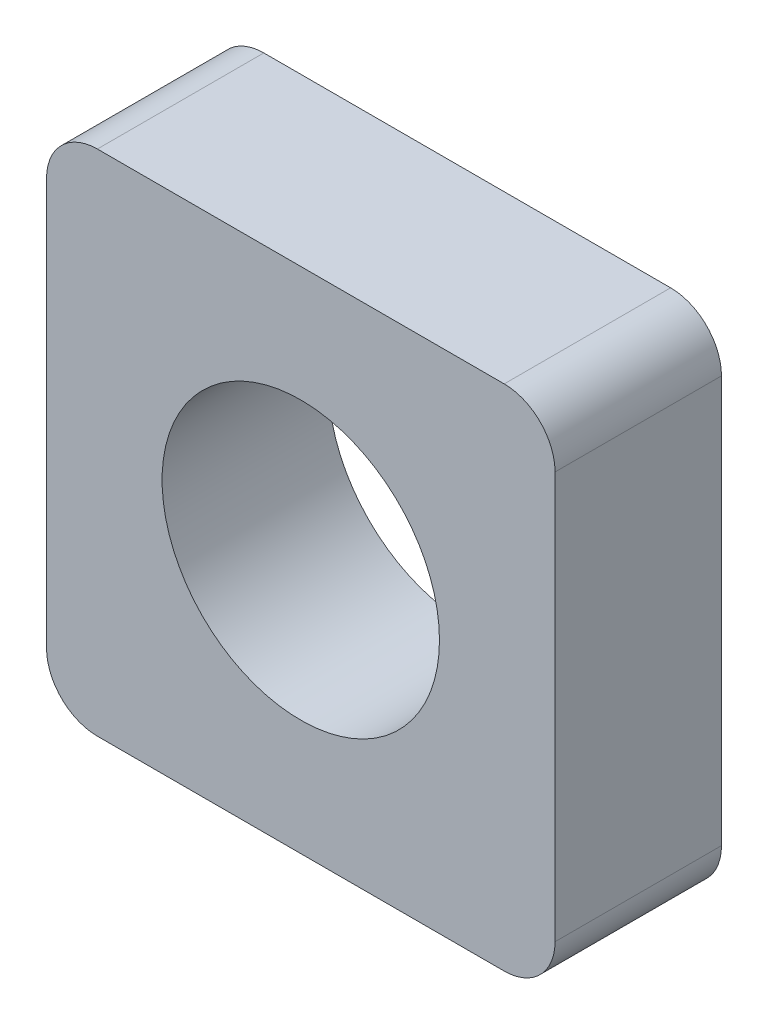
from build123d import *

# Parameters (mm, degrees)
SKETCH1_W           = 5.5
SKETCH1_H           = 5.5
SKETCH1_R           = 1.5
BOSS_EXTRUDE1_DEPTH = 1.8
FILLET1_R           = 0.55


with BuildPart() as part:
    # Sketch1 → Boss-Extrude1 (new body)
    with BuildSketch(Plane.XY):
        Rectangle(SKETCH1_W, SKETCH1_H)
        Circle(SKETCH1_R, mode=Mode.SUBTRACT)
    extrude(amount=BOSS_EXTRUDE1_DEPTH)

    # Fillet1
    fillet1_edges = [part.edges().sort_by_distance(p)[0] for p in [
        (2.75, -2.75, 0.9),
        (-2.75, -2.75, 0.9),
        (-2.75, 2.75, 0.9),
        (2.75, 2.75, 0.9),
    ]]
    fillet(fillet1_edges, radius=FILLET1_R)


solid = part.part
